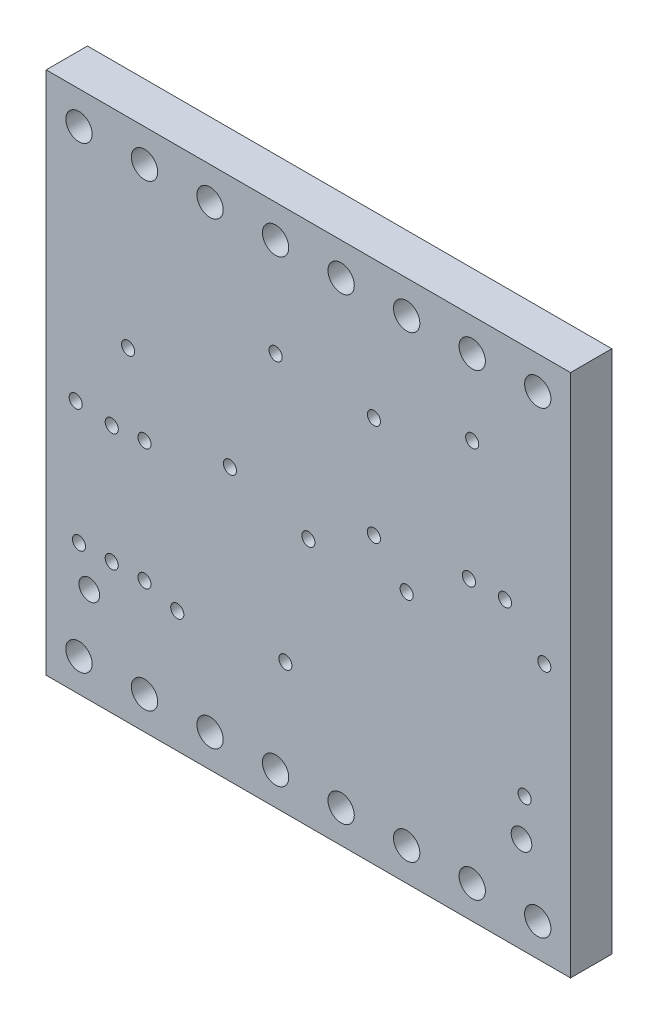
from build123d import *

# Parameters (mm, degrees)
SKETCH1_W           = 20.32
SKETCH1_H           = 20.32
BOARD_OUTLINE_DEPTH = 1.6
SKETCH2_R           = 0.4
SKETCH2_R_2         = 0.254
NPTH_DEPTH          = 15.45721965
SKETCH3_R           = 0.51
PTH_DEPTH           = 15.45721965


with BuildPart() as part:
    # Sketch1 → Board_Outline (new body)
    with BuildSketch(Plane.XY):
        Rectangle(SKETCH1_W, SKETCH1_H)
    extrude(amount=BOARD_OUTLINE_DEPTH)

    # Sketch2 → NPTH (cut, through all)
    with BuildSketch(Plane.XY):
        with Locations((8.26, -6.448)):
            Circle(SKETCH2_R)
        with Locations((-8.49, -6.448)):
            Circle(SKETCH2_R)
        with Locations((-6.985, 2.413)):
            Circle(SKETCH2_R_2)
        with Locations((-3.04, 0.389)):
            Circle(SKETCH2_R_2)
        with Locations((-6.35, -0.381)):
            Circle(SKETCH2_R_2)
        with Locations((-7.62, -5.08)):
            Circle(SKETCH2_R_2)
        with Locations((-7.62, -0.508)):
            Circle(SKETCH2_R_2)
        with Locations((-8.89, -5.08)):
            Circle(SKETCH2_R_2)
        with Locations((0, -0.508)):
            Circle(SKETCH2_R_2)
        with Locations((2.54, 4.826)):
            Circle(SKETCH2_R_2)
        with Locations((2.54, 0.889)):
            Circle(SKETCH2_R_2)
        with Locations((-1.27, 5.08)):
            Circle(SKETCH2_R_2)
        with Locations((-5.08, -5.461)):
            Circle(SKETCH2_R_2)
        with Locations((8.382, -4.953)):
            Circle(SKETCH2_R_2)
        with Locations((-9.017, -0.381)):
            Circle(SKETCH2_R_2)
        with Locations((9.144, -0.127)):
            Circle(SKETCH2_R_2)
        with Locations((3.81, -0.381)):
            Circle(SKETCH2_R_2)
        with Locations((-6.35, -5.08)):
            Circle(SKETCH2_R_2)
        with Locations((7.62, 1.27)):
            Circle(SKETCH2_R_2)
        with Locations((6.223, 1.27)):
            Circle(SKETCH2_R_2)
        with Locations((6.35, 5.969)):
            Circle(SKETCH2_R_2)
        with Locations((-0.889, -5.08)):
            Circle(SKETCH2_R_2)
    extrude(amount=NPTH_DEPTH, mode=Mode.SUBTRACT)

    # Sketch3 → PTH (cut, through all)
    with BuildSketch(Plane.XY):
        with Locations((8.89, 8.89)):
            Circle(SKETCH3_R)
        with Locations((6.35, 8.89)):
            Circle(SKETCH3_R)
        with Locations((3.81, 8.89)):
            Circle(SKETCH3_R)
        with Locations((1.27, 8.89)):
            Circle(SKETCH3_R)
        with Locations((-1.27, 8.89)):
            Circle(SKETCH3_R)
        with Locations((-3.81, 8.89)):
            Circle(SKETCH3_R)
        with Locations((-6.35, 8.89)):
            Circle(SKETCH3_R)
        with Locations((-8.89, 8.89)):
            Circle(SKETCH3_R)
        with Locations((-8.89, -8.89)):
            Circle(SKETCH3_R)
        with Locations((-6.35, -8.89)):
            Circle(SKETCH3_R)
        with Locations((-3.81, -8.89)):
            Circle(SKETCH3_R)
        with Locations((-1.27, -8.89)):
            Circle(SKETCH3_R)
        with Locations((1.27, -8.89)):
            Circle(SKETCH3_R)
        with Locations((3.81, -8.89)):
            Circle(SKETCH3_R)
        with Locations((6.35, -8.89)):
            Circle(SKETCH3_R)
        with Locations((8.89, -8.89)):
            Circle(SKETCH3_R)
    extrude(amount=PTH_DEPTH, mode=Mode.SUBTRACT)


solid = part.part
